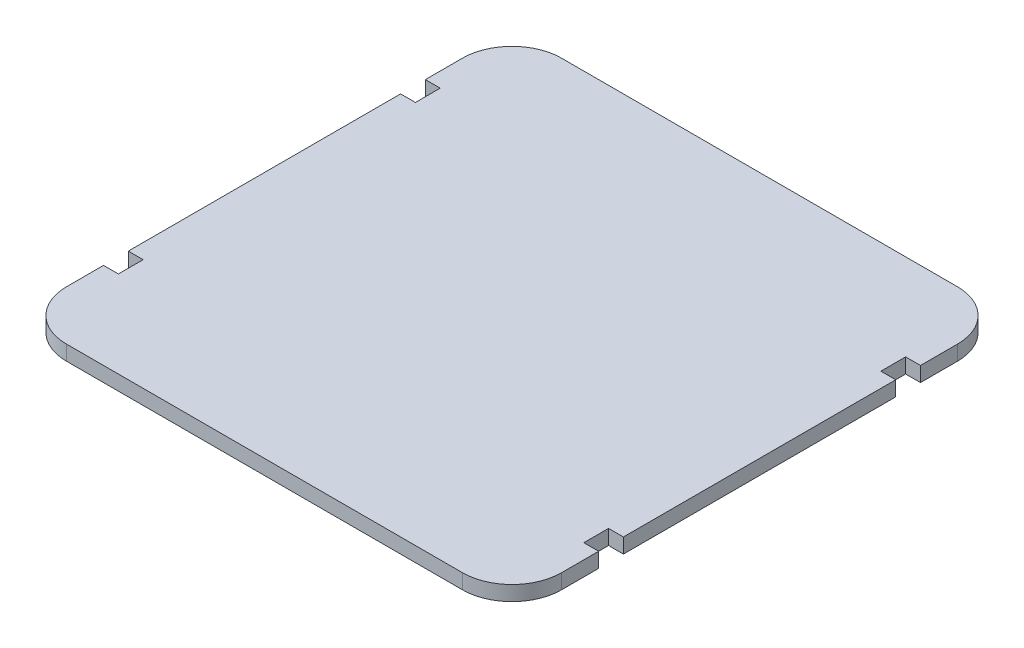
from build123d import *

# Parameters (mm, degrees)
SKETCH1_W               = 254
SKETCH1_H               = 254
PLATFORM_BASE_DEPTH     = 7.62
CORNER_ROUNDING_R       = 25.4
SKETCH8_W               = 7.62
SKETCH8_H               = 12.7
CUT_EXTRUDE4_DEPTH      = 180.766694357
MIRROR7_COPY_1_SKETCH_W = 7.62
MIRROR7_COPY_1_SKETCH_H = 12.7
MIRROR7_COPY_1_DEPTH    = 180.766694357
MIRROR7_COPY_2_SKETCH_W = 7.62
MIRROR7_COPY_2_SKETCH_H = 12.7
MIRROR7_COPY_2_DEPTH    = 180.766694357


with BuildPart() as part:
    # Sketch1 → Platform-Base (new body)
    with BuildSketch(Plane(origin=(0, 0, 0), x_dir=(1, 0, 0), z_dir=(0, 1, 0))):
        Rectangle(SKETCH1_W, SKETCH1_H)
    extrude(amount=PLATFORM_BASE_DEPTH)

    # Corner-Rounding
    corner_rounding_edges = [part.edges().sort_by_distance(p)[0] for p in [
        (-127, 3.81, -127),
        (127, 3.81, -127),
        (127, 3.81, 127),
        (-127, 3.81, 127),
    ]]
    fillet(corner_rounding_edges, radius=CORNER_ROUNDING_R)

    # Sketch8 → Cut-Extrude4 (cut, through all)
    with BuildSketch(Plane(origin=(0, 7.62, 0), x_dir=(1, 0, 0), z_dir=(0, 1, 0))):
        with Locations((-123.19, -76.2)):
            Rectangle(SKETCH8_W, SKETCH8_H)
    cut_extrude4 = extrude(amount=-CUT_EXTRUDE4_DEPTH, mode=Mode.SUBTRACT)

    # Mirror6: Cut-Extrude4 across plane
    add(cut_extrude4.mirror(Plane.XY), mode=Mode.SUBTRACT)

    # Mirror7 copy 1 sketch → Mirror7 copy 1 (cut, through all)
    with BuildSketch(Plane(origin=(0, 7.62, 0), x_dir=(-1, 0, 0), z_dir=(0, 1, 0))):
        with Locations((-123.19, -76.2)):
            Rectangle(MIRROR7_COPY_1_SKETCH_W, MIRROR7_COPY_1_SKETCH_H)
    extrude(amount=-MIRROR7_COPY_1_DEPTH, mode=Mode.SUBTRACT)

    # Mirror7 copy 2 sketch → Mirror7 copy 2 (cut, through all)
    with BuildSketch(Plane(origin=(0, 7.62, 0), x_dir=(-1, 0, 0), z_dir=(0, 1, 0))):
        with Locations((-123.19, 76.2)):
            Rectangle(MIRROR7_COPY_2_SKETCH_W, MIRROR7_COPY_2_SKETCH_H)
    extrude(amount=-MIRROR7_COPY_2_DEPTH, mode=Mode.SUBTRACT)


solid = part.part
